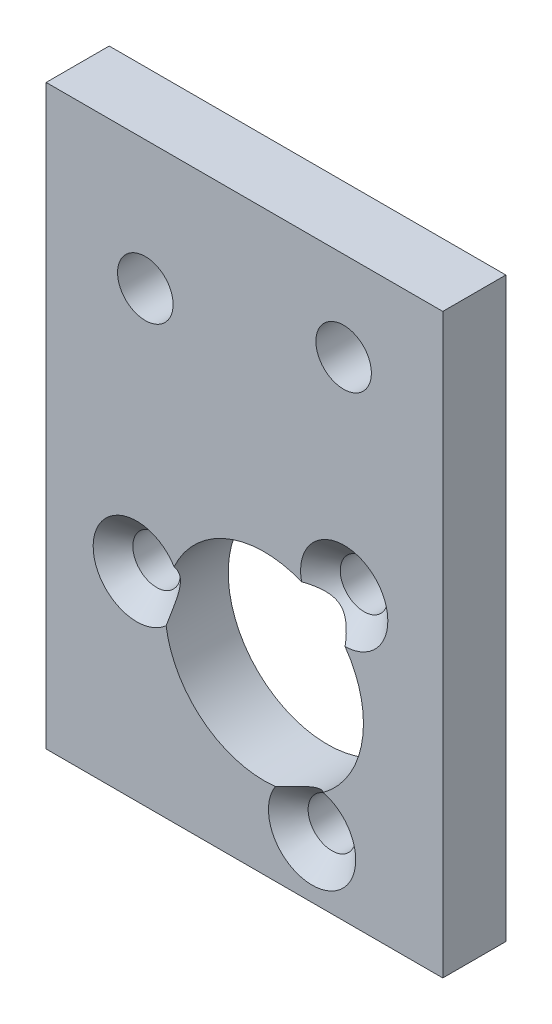
from build123d import *

# Parameters (mm, degrees)
SKETCH1_W                                       = 20
SKETCH1_H                                       = 29.11
SKETCH1_R                                       = 1.4
SKETCH1_R_2                                     = 1.2
SKETCH1_R_3                                     = 5
BOSS_EXTRUDE2_DEPTH                             = 3.18
CSK_FOR_M2_FLAT_HEAD_MACHINE_SCREW1_D           = 2.4
CSK_FOR_M2_FLAT_HEAD_MACHINE_SCREW1_DEPTH       = 3.508967257
CSK_FOR_M2_FLAT_HEAD_MACHINE_SCREW1_CSINK_D     = 4.4
CSK_FOR_M2_FLAT_HEAD_MACHINE_SCREW1_CSINK_ANGLE = 90
CSK_FOR_M2_FLAT_HEAD_MACHINE_SCREW1_TIP         = 0.721032743


with BuildPart() as part:
    # Sketch1 → Boss-Extrude2 (new body)
    with BuildSketch(Plane.XY):
        with Locations((10, 14.555)):
            Rectangle(SKETCH1_W, SKETCH1_H)
        with Locations((5, 22.61)):
            Circle(SKETCH1_R, mode=Mode.SUBTRACT)
        with Locations((15, 24.61)):
            Circle(SKETCH1_R, mode=Mode.SUBTRACT)
        with Locations((15.03, 14.21)):
            Circle(SKETCH1_R_2, mode=Mode.SUBTRACT)
        with Locations((4.57, 10.04)):
            Circle(SKETCH1_R_2, mode=Mode.SUBTRACT)
        with Locations((13.41, 2.96)):
            Circle(SKETCH1_R_2, mode=Mode.SUBTRACT)
        with Locations((11, 9.11)):
            Circle(SKETCH1_R_3, mode=Mode.SUBTRACT)
    extrude(amount=-BOSS_EXTRUDE2_DEPTH)

    # CSK for M2 Flat Head Machine Screw1
    with Locations(Plane.XY):
        with Locations((4.57, 10.04), (15.03, 14.21), (13.41, 2.96)):
            CounterSinkHole(CSK_FOR_M2_FLAT_HEAD_MACHINE_SCREW1_D / 2, CSK_FOR_M2_FLAT_HEAD_MACHINE_SCREW1_CSINK_D / 2, depth=CSK_FOR_M2_FLAT_HEAD_MACHINE_SCREW1_DEPTH, counter_sink_angle=CSK_FOR_M2_FLAT_HEAD_MACHINE_SCREW1_CSINK_ANGLE)
            with Locations((0, 0, -(CSK_FOR_M2_FLAT_HEAD_MACHINE_SCREW1_DEPTH + CSK_FOR_M2_FLAT_HEAD_MACHINE_SCREW1_TIP / 2))):  # 118° drill point
                Cone(0, CSK_FOR_M2_FLAT_HEAD_MACHINE_SCREW1_D / 2, CSK_FOR_M2_FLAT_HEAD_MACHINE_SCREW1_TIP, mode=Mode.SUBTRACT)


solid = part.part
